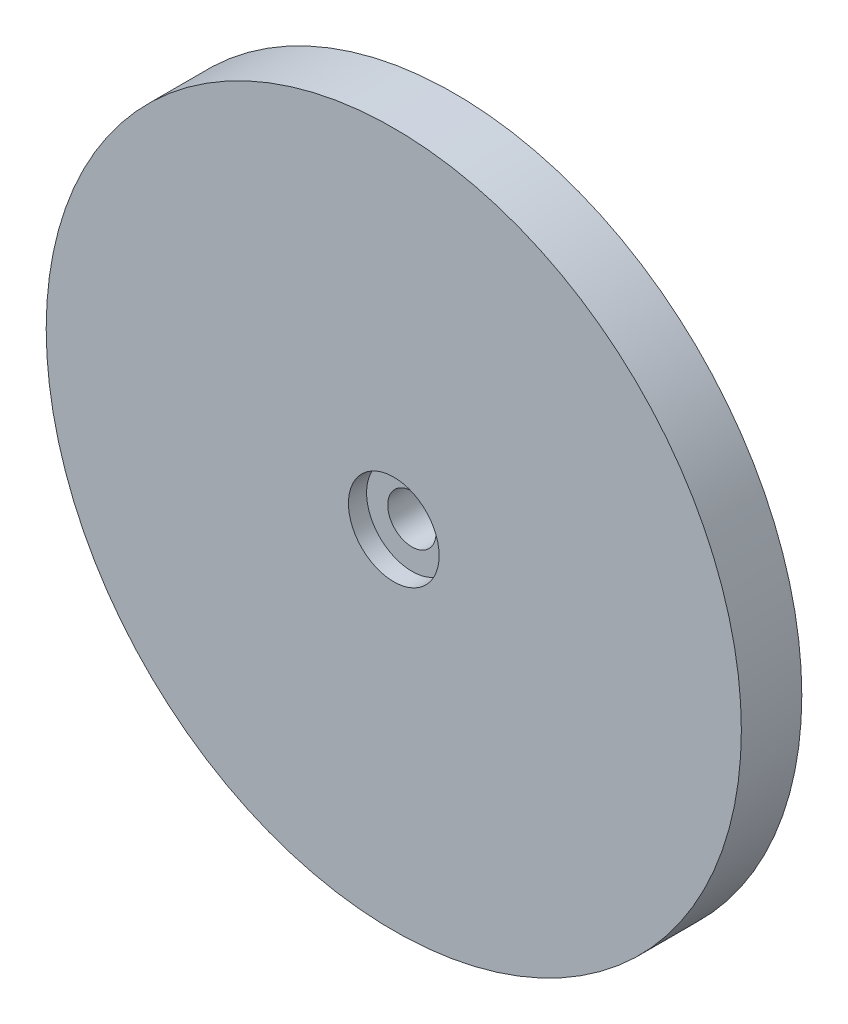
from build123d import *

# Parameters (mm, degrees)
SKETCH1_R           = 57.5
BOSS_EXTRUDE1_DEPTH = 10
SKETCH2_R           = 7.5
SKETCH2_R_2         = 4
CUT_EXTRUDE1_DEPTH  = 3
SKETCH2_2_R         = 4
CUT_EXTRUDE2_DEPTH  = 82.929848041


with BuildPart() as part:
    # Sketch1 → Boss-Extrude1 (new body)
    with BuildSketch(Plane.XY):
        Circle(SKETCH1_R)
    extrude(amount=BOSS_EXTRUDE1_DEPTH)

    # Sketch2 → Cut-Extrude1 (cut)
    with BuildSketch(Plane.XY.offset(10)):
        Circle(SKETCH2_R)
        Circle(SKETCH2_R_2, mode=Mode.SUBTRACT)
    extrude(amount=-CUT_EXTRUDE1_DEPTH, mode=Mode.SUBTRACT)

    # Sketch2<2> → Cut-Extrude2 (cut, through all)
    with BuildSketch(Plane.XY.offset(10)):
        Circle(SKETCH2_2_R)
    extrude(amount=-CUT_EXTRUDE2_DEPTH, mode=Mode.SUBTRACT)


solid = part.part
